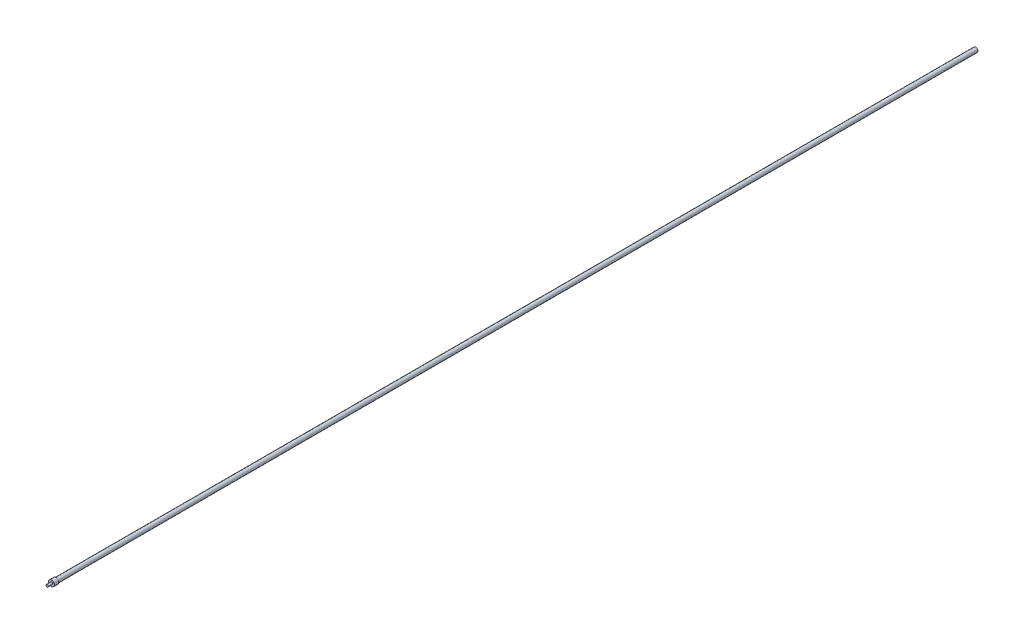
from build123d import *

# Parameters (mm, degrees)
CROQUIS1_R              = 6.35
SALIENTE_EXTRUIR1_DEPTH = 2545
CROQUIS4_R              = 8
SALIENTE_EXTRUIR2_DEPTH = 12
CROQUIS5_R              = 3.175
SALIENTE_EXTRUIR3_DEPTH = 12


with BuildPart() as part:
    # Croquis1 → Saliente-Extruir1 (new body)
    with BuildSketch(Plane.XY):
        Circle(CROQUIS1_R)
    extrude(amount=SALIENTE_EXTRUIR1_DEPTH)

    # Croquis4 → Saliente-Extruir2 (add)
    with BuildSketch(Plane.XY.offset(2545)):
        Circle(CROQUIS4_R)
    extrude(amount=SALIENTE_EXTRUIR2_DEPTH)

    # Croquis5 → Saliente-Extruir3 (add)
    with BuildSketch(Plane.XY.offset(2557)):
        Circle(CROQUIS5_R)
    extrude(amount=SALIENTE_EXTRUIR3_DEPTH)


solid = part.part
